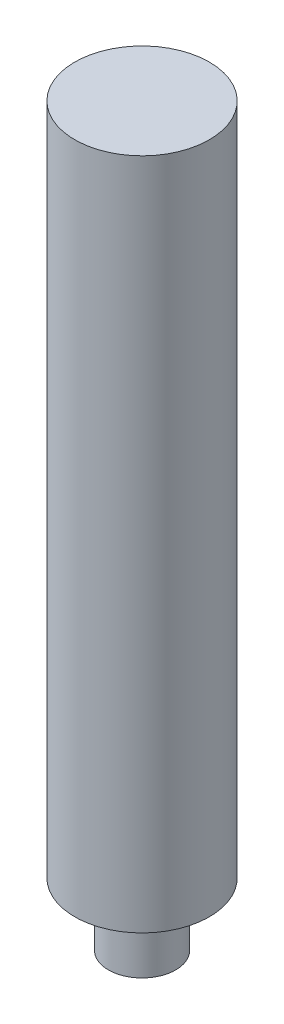
from build123d import *

# Parameters (mm, degrees)
SKETCH_1_R      = 1.5
EXTRUDE_1_DEPTH = 2.8
SKETCH_2_R      = 3
EXTRUDE_2_DEPTH = 30


with BuildPart() as part:
    # 草圖1 → 填料-伸長1 (new body)
    with BuildSketch(Plane(origin=(0, 0, 0), x_dir=(1, 0, 0), z_dir=(0, 1, 0))):
        with Locations(Location((0, 0, 0), (0, 0, 270))):
            Circle(SKETCH_1_R)
    extrude(amount=EXTRUDE_1_DEPTH)

    # 草圖2 → 填料-伸長2 (add)
    with BuildSketch(Plane(origin=(0, 2.8, 0), x_dir=(1, 0, 0), z_dir=(0, 1, 0))):
        with Locations(Location((0, 0, 0), (0, 0, 90))):
            Circle(SKETCH_2_R)
    extrude(amount=EXTRUDE_2_DEPTH)


solid = part.part
